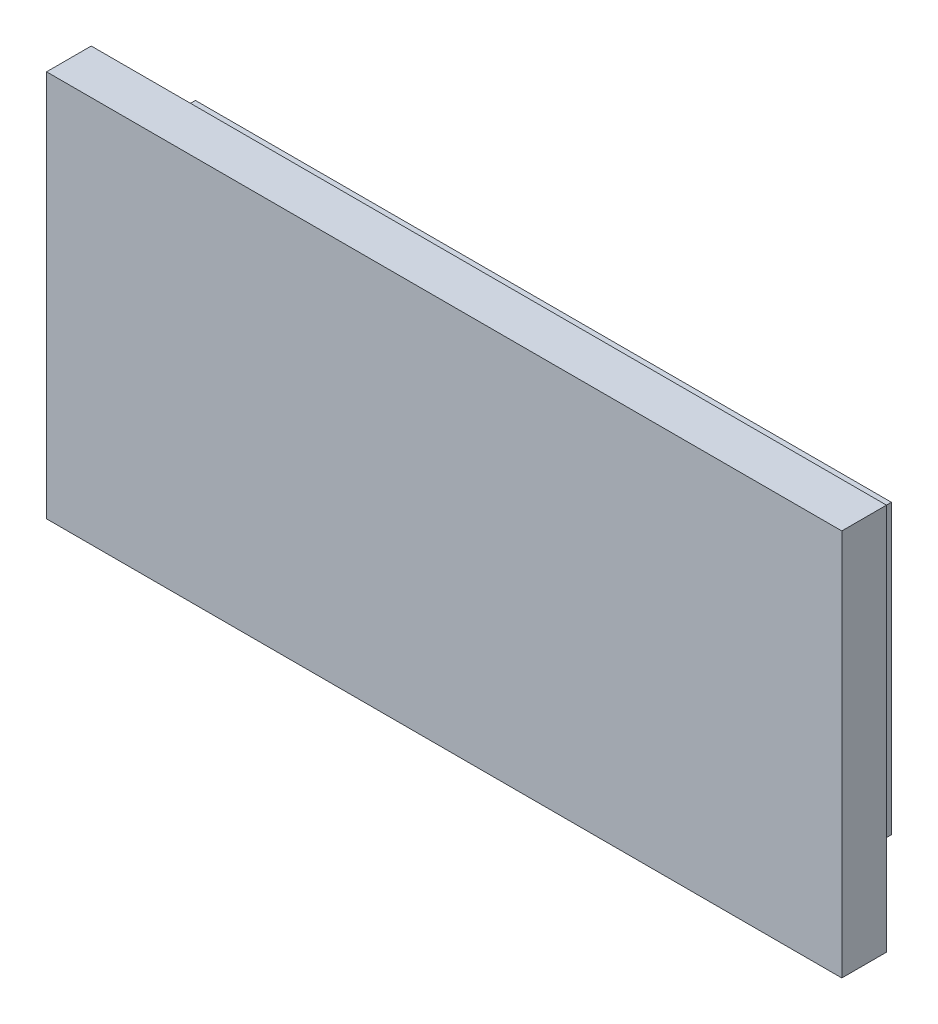
from build123d import *

# Parameters (mm, degrees)
SKETCH1_W           = 16.0208
SKETCH1_H           = 7.8
SKETCH1_W_2         = 14.0208
SKETCH1_H_2         = 5.8
BOSS_EXTRUDE1_DEPTH = 0.9
BOSS_EXTRUDE2_START = -0.9
SKETCH1_4_W         = 14.0208
SKETCH1_4_H         = 5.8
BOSS_EXTRUDE2_DEPTH = 1.1


with BuildPart() as part:
    # Sketch1 → Boss-Extrude1 (new body)
    # profile 1 of 2: a face of its own
    with BuildSketch(Plane.XY):
        with Locations((-113.3983, -100.1518)):
            Rectangle(SKETCH1_W, SKETCH1_H)
        with Locations((-113.3983, -100.1518)):
            Rectangle(SKETCH1_W_2, SKETCH1_H_2, mode=Mode.SUBTRACT)
    # profile 2 of 2: a face of its own
    with BuildSketch(Plane.XY):
        with Locations((-113.3983, -100.1518)):
            Rectangle(SKETCH1_W_2, SKETCH1_H_2)
    extrude(amount=-BOSS_EXTRUDE1_DEPTH)

    # Sketch1<4> → Boss-Extrude2 (add)
    with BuildSketch(Plane.XY.offset(BOSS_EXTRUDE2_START)):
        with Locations((-113.3983, -100.1518)):
            Rectangle(SKETCH1_4_W, SKETCH1_4_H)
    extrude(amount=-BOSS_EXTRUDE2_DEPTH)


solid = part.part
